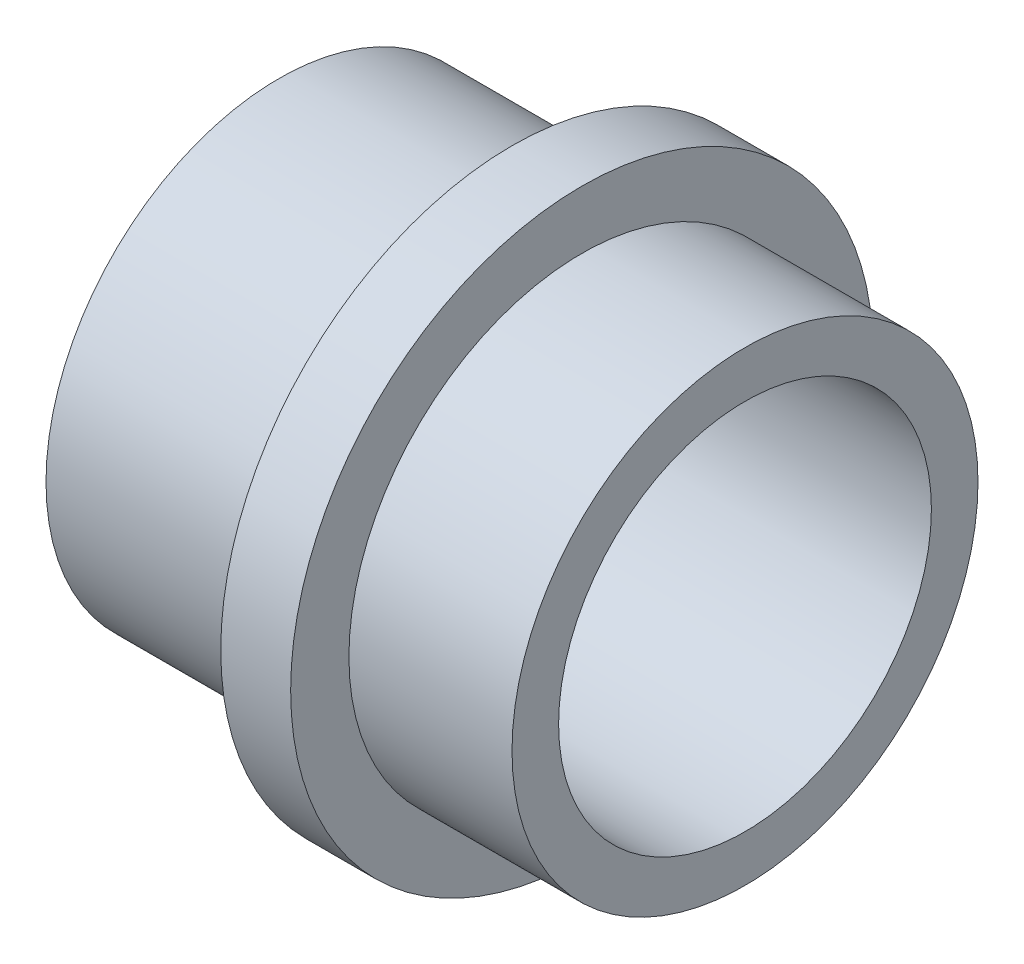
from build123d import *

# Parameters (mm, degrees)
SKETCH1_R           = 1.27
BOSS_EXTRUDE1_DEPTH = 2.54
SKETCH2_W           = 0.381
SKETCH2_H           = 0.3175
SKETCH3_R           = 1.016
CUT_EXTRUDE1_DEPTH  = 4.389972345


with BuildPart() as part:
    # Sketch1 → Boss-Extrude1 (new body)
    with BuildSketch(Plane(origin=(0, 0, 0), x_dir=(0, 0, -1), z_dir=(1, 0, 0))):
        Circle(SKETCH1_R)
    extrude(amount=BOSS_EXTRUDE1_DEPTH)

    # Sketch2 → Revolve1 (revolve)
    with BuildSketch(Plane.XY, mode=Mode.PRIVATE) as revolve1_sk:
        with Locations((1.4605, 1.42875)):
            Rectangle(SKETCH2_W, SKETCH2_H)
    revolve(revolve1_sk.sketch.rotate(Axis((2.54, 0, 0), (-1, 0, 0)), 90), axis=Axis((2.54, 0, 0), (-1, 0, 0)))

    # Sketch3 → Cut-Extrude1 (cut, through all)
    with BuildSketch(Plane(origin=(2.54, 0, 0), x_dir=(0, 0, -1), z_dir=(1, 0, 0))):
        Circle(SKETCH3_R)
    extrude(amount=-CUT_EXTRUDE1_DEPTH, mode=Mode.SUBTRACT)


solid = part.part
